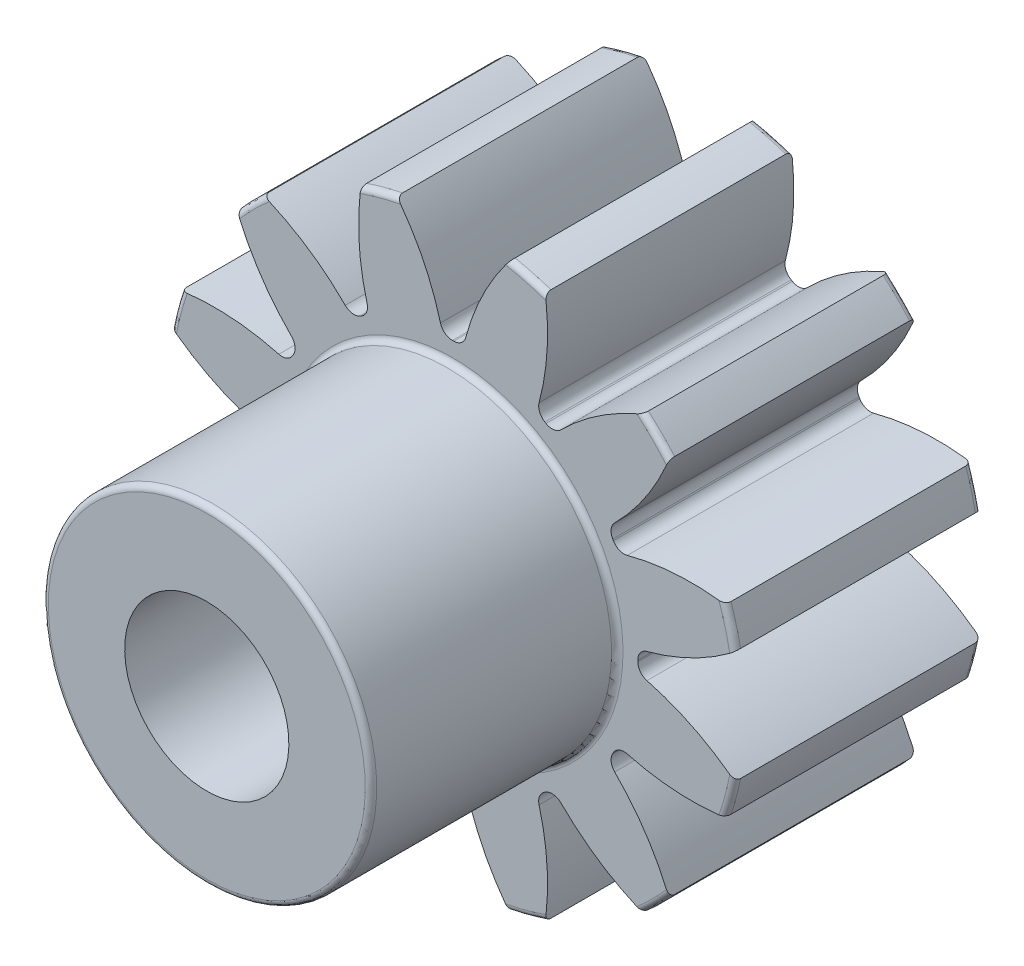
from build123d import *

# Parameters (mm, degrees)
FILLET2_R          = 0.14
CUT_EXTRUDE2_DEPTH = 12.575837024
CIRPATTERN1_COUNT  = 12


with BuildPart() as part:
    # Sketch4 → Revolve1 (revolve)
    with BuildSketch(Plane(origin=(0, 0, 0), x_dir=(0, 0, -1), z_dir=(1, 0, 0))):
        Polygon((-12, 2), (-12, 4), (-6, 4), (-6, 7), (0, 7), (0, 2), align=None)
    revolve(axis=Axis((0, 0, 6), (0, 0, 1)))

    # Fillet2
    fillet2_edges = [part.edges().sort_by_distance(p)[0] for p in [
        (0, -7, 0),
        (0, -7, 6),
        (0, -4, 6),
        (0, -4, 12),
    ]]
    fillet(fillet2_edges, radius=FILLET2_R)

    # Sketch7 → Cut-Extrude2 (cut, through all)
    with BuildSketch(Plane.XY.offset(6)):
        with BuildLine():
            ThreePointArc((-0.016433478, 4.499969993), (0, 4.5), (0.016433478, 4.499969993))
            ThreePointArc((0.016433478, 4.499969993), (0.199907289, 4.561764499), (0.307439354, 4.722755355))
            ThreePointArc((0.307439354, 4.722755355), (0.731505846, 5.847106195), (1.371117638, 6.864403574))
            ThreePointArc((1.371117638, 6.864403574), (0, 7), (-1.371117638, 6.864403574))
            ThreePointArc((-1.371117638, 6.864403574), (-0.731505846, 5.847106195), (-0.307439354, 4.722755355))
            ThreePointArc((-0.307439354, 4.722755355), (-0.199907289, 4.561764499), (-0.016433478, 4.499969993))
        make_face()
    cut_extrude2 = extrude(amount=-CUT_EXTRUDE2_DEPTH, mode=Mode.SUBTRACT)

    # CirPattern1: Cut-Extrude2 ×12 about axis
    cirpattern1_axis = Axis((0, 0, 0), (0, 0, 1))
    for i in range(1, CIRPATTERN1_COUNT):
        add(cut_extrude2.rotate(cirpattern1_axis, i * 360 / CIRPATTERN1_COUNT), mode=Mode.SUBTRACT)


solid = part.part
